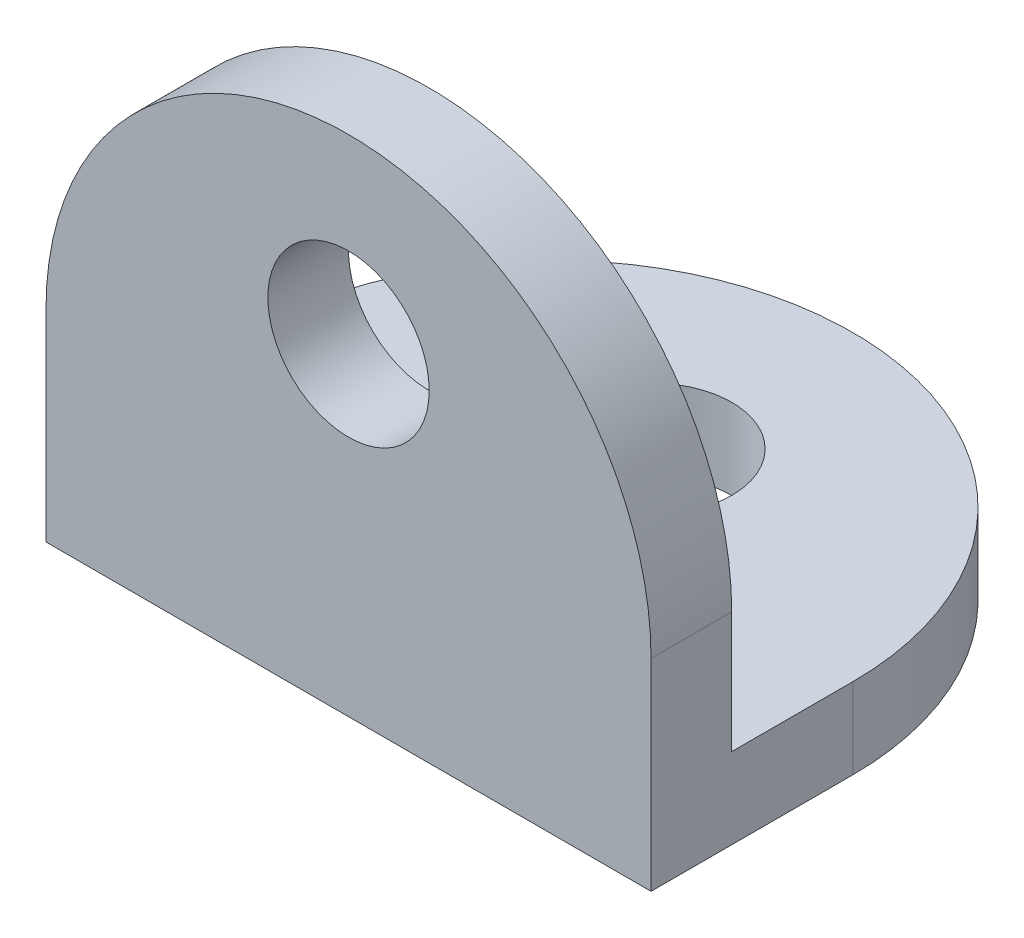
from build123d import *

# Parameters (mm, degrees)
SKETCH_2_R      = 2
SKETCH_2_W      = 15
SKETCH_2_H      = 5
EXTRUDE_1_DEPTH = 2
SKETCH_1_W      = 15
SKETCH_1_H      = 5
SKETCH_1_R      = 2
EXTRUDE_2_DEPTH = 2


with BuildPart() as part:
    # 草图2 → 凸台-拉伸1 (new body)
    # profile 1 of 2: a face of its own
    with BuildSketch(Plane(origin=(0, 0, 0), x_dir=(1, 0, 0), z_dir=(0, 1, 0))):
        with BuildLine():
            ThreePointArc((-7.5, 5), (0, 12.5), (7.5, 5))
            Line((7.5, 5), (-7.5, 5))
        make_face()
        with Locations(Location((0, 7.5, 0), (0, 0, 270))):
            Circle(SKETCH_2_R, mode=Mode.SUBTRACT)
    # profile 2 of 2: a face of its own
    with BuildSketch(Plane(origin=(0, 0, 0), x_dir=(1, 0, 0), z_dir=(0, 1, 0))):
        with Locations((0, 2.5)):
            Rectangle(SKETCH_2_W, SKETCH_2_H)
    extrude(amount=EXTRUDE_1_DEPTH)

    # 草图1 → 凸台-拉伸2 (add)
    # profile 1 of 2: a face of its own
    with BuildSketch(Plane.XY):
        with Locations((0, 2.5)):
            Rectangle(SKETCH_1_W, SKETCH_1_H)
    # profile 2 of 2: a face of its own
    with BuildSketch(Plane.XY):
        with BuildLine():
            ThreePointArc((-7.5, 5), (0, 12.5), (7.5, 5))
            Line((7.5, 5), (-7.5, 5))
        make_face()
        with Locations((0, 8)):
            Circle(SKETCH_1_R, mode=Mode.SUBTRACT)
    extrude(amount=-EXTRUDE_2_DEPTH)


solid = part.part
